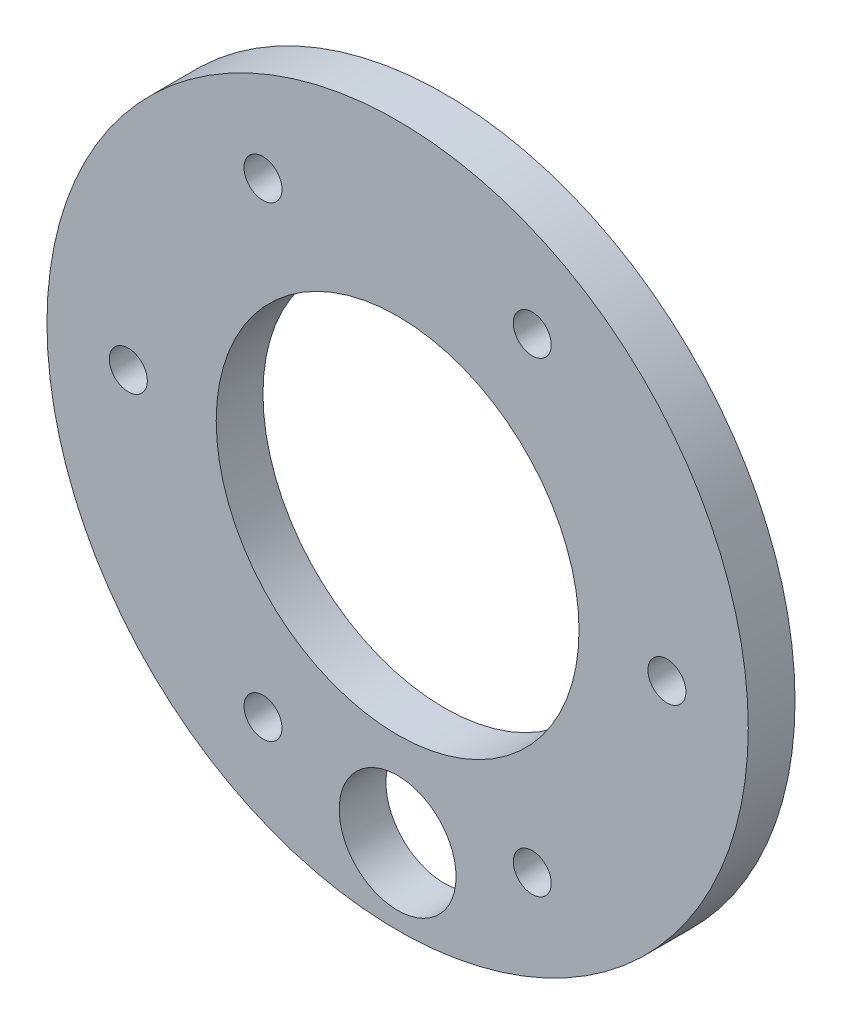
from build123d import *

# Parameters (mm, degrees)
SKETCH1_R                  = 95.25
F001_EXTRUDE_BOSS_DEPTH    = 12.7
SKETCH2_R                  = 49.276
F002_HOLE_DEPTH            = 270.706859386
SKETCH3_R                  = 5.1562
F003_SEEDHOLECUT_DEPTH     = 270.706859386
F003_CIRCULARPATTERN_COUNT = 6
SKETCH4_R                  = 15.875
F004_EXTRUDE_CUT_DEPTH     = 270.706859386


with BuildPart() as part:
    # Sketch1 → F001_extrude_boss (new body)
    with BuildSketch(Plane.XY):
        with Locations((95.25, 95.25)):
            Circle(SKETCH1_R)
    extrude(amount=F001_EXTRUDE_BOSS_DEPTH)

    # Sketch2 → F002_hole (cut, through all)
    with BuildSketch(Plane.XY):
        with Locations((95.25, 95.25)):
            Circle(SKETCH2_R)
    extrude(amount=F002_HOLE_DEPTH, mode=Mode.SUBTRACT)

    # Sketch3 → F003_SeedHoleCut (cut, through all)
    with BuildSketch(Plane.XY):
        with Locations((58.6751176, 31.900445402)):
            Circle(SKETCH3_R)
    f003_seedholecut = extrude(amount=F003_SEEDHOLECUT_DEPTH, mode=Mode.SUBTRACT)

    # F003_CircularPattern: F003_SeedHoleCut ×6 about axis
    f003_circularpattern_axis = Axis((95.25, 95.25, 12.7), (0, 0, -1))
    for i in range(1, F003_CIRCULARPATTERN_COUNT):
        add(f003_seedholecut.rotate(f003_circularpattern_axis, i * 360 / F003_CIRCULARPATTERN_COUNT), mode=Mode.SUBTRACT)

    # Sketch4 → F004_extrude_cut (cut, through all)
    with BuildSketch(Plane.XY):
        with Locations((95.25, 20.574)):
            Circle(SKETCH4_R)
    extrude(amount=F004_EXTRUDE_CUT_DEPTH, mode=Mode.SUBTRACT)


solid = part.part
